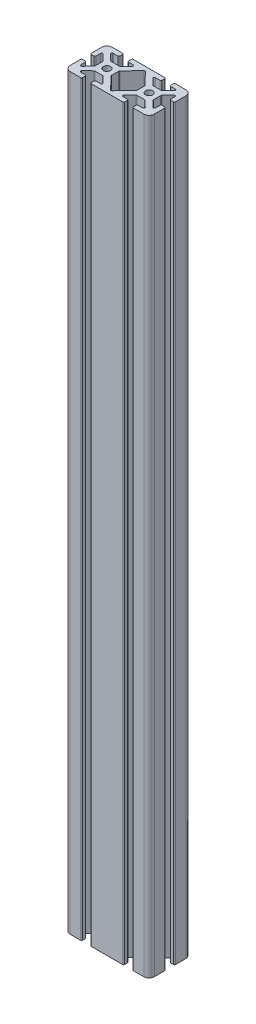
from build123d import *

# Parameters (mm, degrees)
BOSS_EXTRUDE1_DEPTH   = 710
SKETCH3_R             = 3.4
CUT_EXTRUDE1_DEPTH    = 716.611626513
CUT_EXTRUDE2_DEPTH    = 716.611626513
FILLET1_R             = 1
FILLET2_R             = 1
FILLET3_R             = 1
CUT_EXTRUDE3_DEPTH    = 716.611626513
CUT_EXTRUDE4_DEPTH    = 716.611626513
FILLET4_R             = 1
FILLET5_R             = 1
FILLET6_R             = 1
FILLET7_R             = 1
FILLET8_R             = 1
FILLET9_R             = 1
FILLET10_R            = 1
FILLET11_R            = 1
MIRROR11_COPY_1_DEPTH = 716.611626513
MIRROR11_COPY_2_DEPTH = 716.611626513
CUT_EXTRUDE5_DEPTH    = 1000


with BuildPart() as part:
    # Sketch1 → Boss-Extrude1 (new body)
    with BuildSketch(Plane(origin=(0, 0, 0), x_dir=(1, 0, 0), z_dir=(0, 1, 0))):
        with BuildLine():
            Line((5, 0), (75, 0))
            ThreePointArc((75, 0), (78.535533906, -1.464466094), (80, -5))
            Line((80, -5), (80, -35))
            ThreePointArc((80, -35), (78.535533906, -38.535533906), (75, -40))
            Line((75, -40), (5, -40))
            ThreePointArc((5, -40), (1.464466094, -38.535533906), (0, -35))
            Line((0, -35), (0, -5))
            ThreePointArc((0, -5), (1.464466094, -1.464466094), (5, 0))
        make_face()
    extrude(amount=BOSS_EXTRUDE1_DEPTH)

    # Sketch3 → Cut-Extrude1 (cut, through all)
    with BuildSketch(Plane(origin=(0, 710, 0), x_dir=(1, 0, 0), z_dir=(0, 1, 0))):
        with Locations(Location((20, -20, 0), (0, 0, 270))):
            Circle(SKETCH3_R)
    cut_extrude1 = extrude(amount=-CUT_EXTRUDE1_DEPTH, mode=Mode.SUBTRACT)

    # Mirror3: Cut-Extrude1 across plane
    add(cut_extrude1.mirror(Plane(origin=(40, 0, 0), x_dir=(0, 0, 1), z_dir=(1, 0, 0))), mode=Mode.SUBTRACT)

    # Sketch7 → Cut-Extrude2 (cut, symmetric)
    with BuildSketch(Plane(origin=(0, 0, 0), x_dir=(-1, 0, 0), z_dir=(0, -1, 0))):
        with BuildLine():
            Line((-15.9, -40), (-24.1, -40))
            Line((-24.1, -40), (-24.1, -36.5))
            ThreePointArc((-24.1, -36.5), (-24.392893219, -35.792893219), (-25.1, -35.5))
            Line((-25.1, -35.5), (-29.489753594, -35.5))
            ThreePointArc((-29.489753594, -35.5), (-30.415270825, -34.8787055), (-30.190750526, -33.786835712))
            Line((-30.190750526, -33.786835712), (-24.391814382, -28.086835712))
            ThreePointArc((-24.391814382, -28.086835712), (-24.069522951, -27.874482769), (-23.69081745, -27.8))
            Line((-23.69081745, -27.8), (-16.309186536, -27.8))
            ThreePointArc((-16.309186536, -27.8), (-15.930477876, -27.874484063), (-15.608184734, -28.086840499))
            Line((-15.608184734, -28.086840499), (-9.809327805, -33.786840499))
            ThreePointArc((-9.809327805, -33.786840499), (-9.584813669, -34.87870866), (-10.510329607, -35.5))
            Line((-10.510329607, -35.5), (-14.9, -35.5))
            ThreePointArc((-14.9, -35.5), (-15.607106781, -35.792893219), (-15.9, -36.5))
            Line((-15.9, -36.5), (-15.9, -40))
        make_face()
    cut_extrude2 = extrude(amount=CUT_EXTRUDE2_DEPTH, both=True, mode=Mode.SUBTRACT)

    # Fillet1
    fillet1_edges = [part.edges().sort_by_distance(p)[0] for p in [
        (15.9, 355, 40),
        (24.1, 355, 40),
    ]]
    fillet(fillet1_edges, radius=FILLET1_R)

    # Mirror8: Cut-Extrude2 across plane
    add(cut_extrude2.mirror(Plane(origin=(40, 0, 0), x_dir=(0, 0, 1), z_dir=(1, 0, 0))), mode=Mode.SUBTRACT)

    # Fillet2
    fillet2_edges = [part.edges().sort_by_distance(p)[0] for p in [
        (55.9, 355, 40),
    ]]
    fillet(fillet2_edges, radius=FILLET2_R)

    # Fillet3
    fillet3_edges = [part.edges().sort_by_distance(p)[0] for p in [
        (64.1, 355, 40),
    ]]
    fillet(fillet3_edges, radius=FILLET3_R)

    # Sketch9 → Cut-Extrude3 (cut, through all)
    with BuildSketch(Plane(origin=(0, 0, 0), x_dir=(1, 0, 0), z_dir=(0, 1, 0))):
        with BuildLine():
            Line((14.899846923, -4.500713815), (10.450461284, -4.500713815))
            ThreePointArc((10.450461284, -4.500713815), (9.526581751, -5.118030383), (9.743354502, -6.207820596))
            Line((9.743354502, -6.207820596), (15.442640687, -11.907106781))
            ThreePointArc((15.442640687, -11.907106781), (15.767064036, -12.123879533), (16.149747468, -12.2))
            Line((16.149747468, -12.2), (23.850252532, -12.2))
            ThreePointArc((23.850252532, -12.2), (24.232935964, -12.123879533), (24.557359313, -11.907106781))
            Line((24.557359313, -11.907106781), (30.257359313, -6.207106781))
            ThreePointArc((30.257359313, -6.207106781), (30.474132064, -5.117316568), (29.550252532, -4.5))
            Line((29.550252532, -4.5), (25.099846964, -4.5))
            ThreePointArc((25.099846964, -4.5), (24.392724723, -4.207091321), (24.099846965, -3.499956273))
            Line((24.099846965, -3.499956273), (24.100000008, 0))
            Line((24.100000008, 0), (15.9, 0))
            Line((15.9, 0), (15.899846922, -3.500757542))
            ThreePointArc((15.899846922, -3.500757542), (15.606938244, -4.207836056), (14.899846923, -4.500713815))
        make_face()
    cut_extrude3 = extrude(amount=CUT_EXTRUDE3_DEPTH, mode=Mode.SUBTRACT)

    # Mirror9: Cut-Extrude3 across plane
    add(cut_extrude3.mirror(Plane(origin=(40, 0, 0), x_dir=(0, 0, 1), z_dir=(1, 0, 0))), mode=Mode.SUBTRACT)

    # Sketch10 → Cut-Extrude4 (cut, through all)
    with BuildSketch(Plane(origin=(0, 0, 0), x_dir=(1, 0, 0), z_dir=(0, 1, 0))):
        with BuildLine():
            Line((4.5, -14.9), (4.5, -10.58605332))
            ThreePointArc((4.5, -10.58605332), (5.126159695, -9.658560233), (6.220486853, -9.892584724))
            Line((6.220486853, -9.892584724), (11.920486853, -15.814662646))
            ThreePointArc((11.920486853, -15.814662646), (12.127493087, -16.134290938), (12.2, -16.508131242))
            Line((12.2, -16.508131242), (12.2, -23.491868758))
            ThreePointArc((12.2, -23.491868758), (12.127493087, -23.865709062), (11.920486853, -24.185337354))
            Line((11.920486853, -24.185337354), (6.220486853, -30.107415276))
            ThreePointArc((6.220486853, -30.107415276), (5.126159695, -30.341439767), (4.5, -29.41394668))
            Line((4.5, -29.41394668), (4.5, -25.1))
            ThreePointArc((4.5, -25.1), (4.207106781, -24.392893219), (3.5, -24.1))
            Line((3.5, -24.1), (0, -24.1))
            Line((0, -24.1), (0, -15.9))
            Line((0, -15.9), (3.5, -15.9))
            ThreePointArc((3.5, -15.9), (4.207106781, -15.607106781), (4.5, -14.9))
        make_face()
    cut_extrude4 = extrude(amount=CUT_EXTRUDE4_DEPTH, mode=Mode.SUBTRACT)

    # Fillet4
    fillet4_edges = [part.edges().sort_by_distance(p)[0] for p in [
        (24.100000008, 355, 0),
    ]]
    fillet(fillet4_edges, radius=FILLET4_R)

    # Fillet5
    fillet5_edges = [part.edges().sort_by_distance(p)[0] for p in [
        (64.1, 355, 0),
    ]]
    fillet(fillet5_edges, radius=FILLET5_R)

    # Fillet6
    fillet6_edges = [part.edges().sort_by_distance(p)[0] for p in [
        (55.899999992, 355, 0),
    ]]
    fillet(fillet6_edges, radius=FILLET6_R)

    # Fillet7
    fillet7_edges = [part.edges().sort_by_distance(p)[0] for p in [
        (15.9, 355, 0),
    ]]
    fillet(fillet7_edges, radius=FILLET7_R)

    # Fillet8
    fillet8_edges = [part.edges().sort_by_distance(p)[0] for p in [
        (0, 355, 24.1),
    ]]
    fillet(fillet8_edges, radius=FILLET8_R)

    # Fillet9
    fillet9_edges = [part.edges().sort_by_distance(p)[0] for p in [
        (0, 355, 15.9),
    ]]
    fillet(fillet9_edges, radius=FILLET9_R)

    # Mirror10: Cut-Extrude4 across plane
    add(cut_extrude4.mirror(Plane(origin=(40, 0, 0), x_dir=(0, 0, 1), z_dir=(1, 0, 0))), mode=Mode.SUBTRACT)

    # Fillet10
    fillet10_edges = [part.edges().sort_by_distance(p)[0] for p in [
        (80, 355, 15.9),
    ]]
    fillet(fillet10_edges, radius=FILLET10_R)

    # Fillet11
    fillet11_edges = [part.edges().sort_by_distance(p)[0] for p in [
        (80, 355, 24.1),
    ]]
    fillet(fillet11_edges, radius=FILLET11_R)

    # Mirror11 copy 1 sketch → Mirror11 copy 1 (cut, through all)
    with BuildSketch(Plane(origin=(40, 0, 0), x_dir=(1, 0, 0), z_dir=(0, 1, 0))):
        with BuildLine():
            Line((4.5, -14.9), (4.5, -10.58605332))
            ThreePointArc((4.5, -10.58605332), (5.126159695, -9.658560233), (6.220486853, -9.892584724))
            Line((6.220486853, -9.892584724), (11.920486853, -15.814662646))
            ThreePointArc((11.920486853, -15.814662646), (12.127493087, -16.134290938), (12.2, -16.508131242))
            Line((12.2, -16.508131242), (12.2, -23.491868758))
            ThreePointArc((12.2, -23.491868758), (12.127493087, -23.865709062), (11.920486853, -24.185337354))
            Line((11.920486853, -24.185337354), (6.220486853, -30.107415276))
            ThreePointArc((6.220486853, -30.107415276), (5.126159695, -30.341439767), (4.5, -29.41394668))
            Line((4.5, -29.41394668), (4.5, -25.1))
            ThreePointArc((4.5, -25.1), (4.207106781, -24.392893219), (3.5, -24.1))
            Line((3.5, -24.1), (0, -24.1))
            Line((0, -24.1), (0, -15.9))
            Line((0, -15.9), (3.5, -15.9))
            ThreePointArc((3.5, -15.9), (4.207106781, -15.607106781), (4.5, -14.9))
        make_face()
    extrude(amount=MIRROR11_COPY_1_DEPTH, mode=Mode.SUBTRACT)

    # Mirror11 copy 2 sketch → Mirror11 copy 2 (cut, through all)
    with BuildSketch(Plane(origin=(120, 0, 0), x_dir=(-1, 0, 0), z_dir=(0, 1, 0))):
        with BuildLine():
            Line((4.5, 14.9), (4.5, 10.58605332))
            ThreePointArc((4.5, 10.58605332), (5.126159695, 9.658560233), (6.220486853, 9.892584724))
            Line((6.220486853, 9.892584724), (11.920486853, 15.814662646))
            ThreePointArc((11.920486853, 15.814662646), (12.127493087, 16.134290938), (12.2, 16.508131242))
            Line((12.2, 16.508131242), (12.2, 23.491868758))
            ThreePointArc((12.2, 23.491868758), (12.127493087, 23.865709062), (11.920486853, 24.185337354))
            Line((11.920486853, 24.185337354), (6.220486853, 30.107415276))
            ThreePointArc((6.220486853, 30.107415276), (5.126159695, 30.341439767), (4.5, 29.41394668))
            Line((4.5, 29.41394668), (4.5, 25.1))
            ThreePointArc((4.5, 25.1), (4.207106781, 24.392893219), (3.5, 24.1))
            Line((3.5, 24.1), (0, 24.1))
            Line((0, 24.1), (0, 15.9))
            Line((0, 15.9), (3.5, 15.9))
            ThreePointArc((3.5, 15.9), (4.207106781, 15.607106781), (4.5, 14.9))
        make_face()
    extrude(amount=MIRROR11_COPY_2_DEPTH, mode=Mode.SUBTRACT)

    # Mirror12: Cut-Extrude4 across plane
    add(cut_extrude4.mirror(Plane.ZY.offset(-20)), mode=Mode.SUBTRACT)

    # Sketch12 → Cut-Extrude5 (cut)
    with BuildSketch(Plane(origin=(0, 0, 0), x_dir=(-1, 0, 0), z_dir=(0, -1, 0))):
        with BuildLine():
            Line((-28.079513147, -24.185337354), (-39.327067998, -35.871108628))
            ThreePointArc((-39.327067998, -35.871108628), (-40.049082116, -36.177638866), (-40.770156561, -35.868904648))
            Line((-40.770156561, -35.868904648), (-51.922601709, -24.210885791))
            ThreePointArc((-51.922601709, -24.210885791), (-52.128062958, -23.892044517), (-52.2, -23.519621175))
            Line((-52.2, -23.519621175), (-52.2, -16.508131242))
            ThreePointArc((-52.2, -16.508131242), (-52.127493087, -16.134290938), (-51.920486853, -15.814662646))
            Line((-51.920486853, -15.814662646), (-40.720486853, -4.17829901))
            ThreePointArc((-40.720486853, -4.17829901), (-40, -3.871767606), (-39.279513147, -4.17829901))
            Line((-39.279513147, -4.17829901), (-28.079513147, -15.814662646))
            ThreePointArc((-28.079513147, -15.814662646), (-27.872506913, -16.134290938), (-27.8, -16.508131242))
            Line((-27.8, -16.508131242), (-27.8, -23.491868758))
            ThreePointArc((-27.8, -23.491868758), (-27.872506913, -23.865709062), (-28.079513147, -24.185337354))
        make_face()
    extrude(amount=-CUT_EXTRUDE5_DEPTH, mode=Mode.SUBTRACT)


solid = part.part
